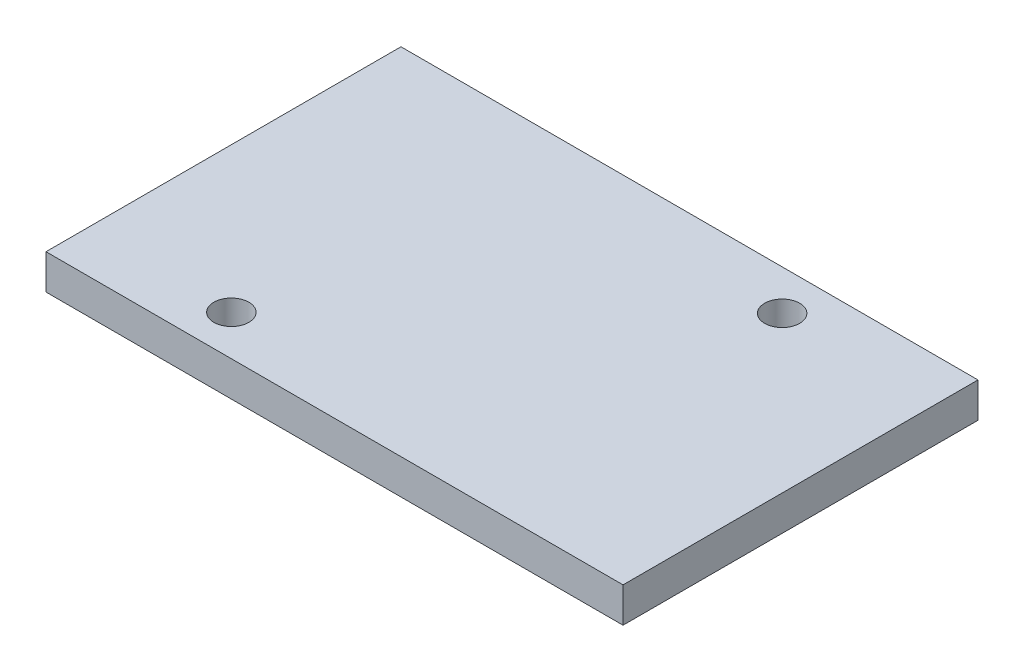
from build123d import *

# Parameters (mm, degrees)
SKETCH1_W           = 33
SKETCH1_H           = 20.3
SKETCH1_R           = 1
BOSS_EXTRUDE1_DEPTH = 2


with BuildPart() as part:
    # Sketch1 → Boss-Extrude1 (new body)
    with BuildSketch(Plane(origin=(0, 0, 0), x_dir=(1, 0, 0), z_dir=(0, 1, 0))):
        with Locations((-101.769565217, 18.203804348)):
            Rectangle(SKETCH1_W, SKETCH1_H)
        with Locations(Location((-109.969565217, 10.353804348, 0), (0, 0, 270))):
            Circle(SKETCH1_R, mode=Mode.SUBTRACT)
        with Locations(Location((-94.169565217, 26.053804348, 0), (0, 0, 270))):
            Circle(SKETCH1_R, mode=Mode.SUBTRACT)
    extrude(amount=BOSS_EXTRUDE1_DEPTH)


solid = part.part
